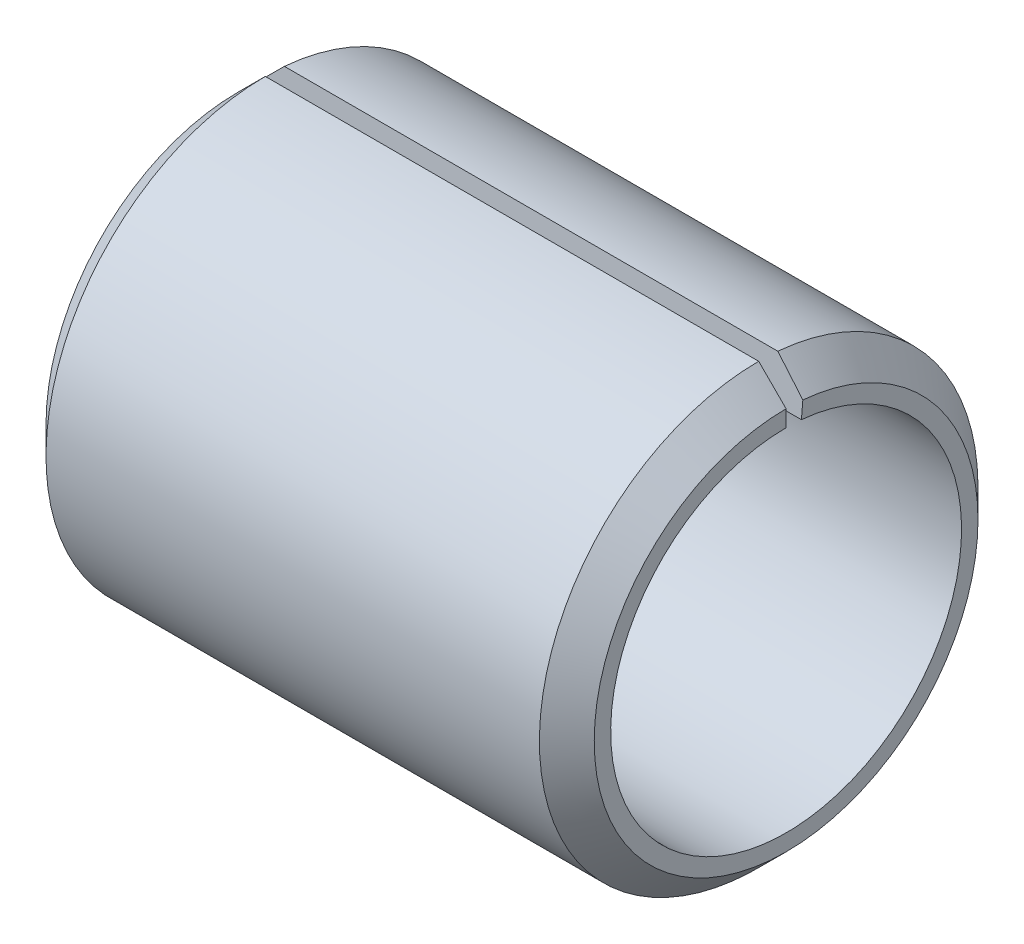
from build123d import *

# Parameters (mm, degrees)
ESQUISSE1_W       = 10
ESQUISSE1_H       = 0.8
R_VOLUTION1_ANGLE = 355
CHANFREIN1_SIZE   = 0.5


with BuildPart() as part:
    # Esquisse1 → Révolution1 (revolve)
    with BuildSketch(Plane.XY):
        with Locations((0, 3.6)):
            Rectangle(ESQUISSE1_W, ESQUISSE1_H)
    revolve(axis=Axis((-7.531341075, 0, 0), (1, 0, 0)), revolution_arc=R_VOLUTION1_ANGLE)

    # Chanfrein1
    chanfrein1_edges = [part.edges().sort_by_distance(p)[0] for p in [
        (5, -3.996192886, 0.174477549),
        (-5, -3.996192886, 0.174477549),
    ]]
    chamfer(chanfrein1_edges, length=CHANFREIN1_SIZE)


solid = part.part
